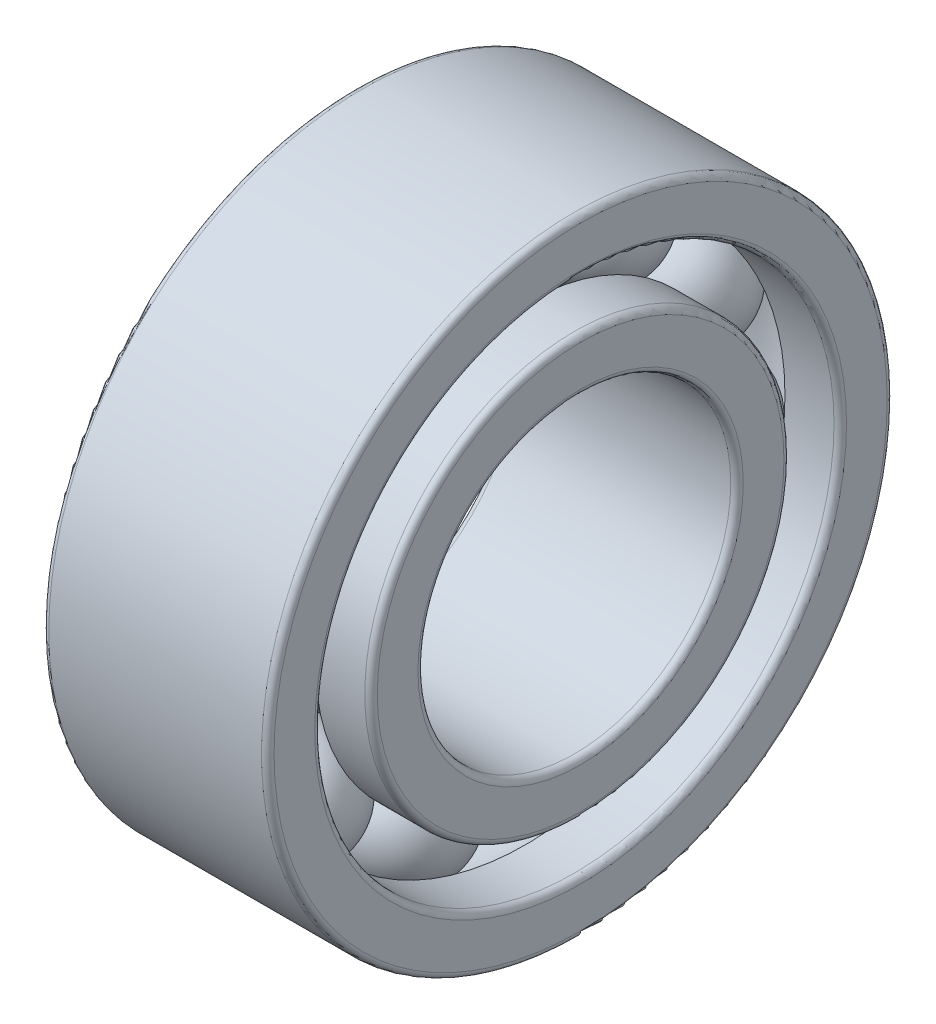
from build123d import *

# Parameters (mm, degrees)
CIRPATTERN4_COUNT = 11
FILLET1_R         = 0.5
FILLET2_R         = 0.5


with BuildPart() as part:
    # Sketch1 → Revolve1 (revolve)
    with BuildSketch(Plane.XY, mode=Mode.PRIVATE) as revolve1_sk:
        with BuildLine():
            Line((0, 25), (-18, 25))
            Line((-18, 25), (-18, 20.75))
            Line((-18, 20.75), (-13.582575695, 20.75))
            ThreePointArc((-13.582575695, 20.75), (-9, 23.75), (-4.417424305, 20.75))
            Line((-4.417424305, 20.75), (0, 20.75))
            Line((0, 20.75), (0, 25))
        make_face()
        with BuildLine():
            Line((-18, 12.5), (0, 12.5))
            Line((0, 12.5), (0, 16.75))
            Line((0, 16.75), (-4.417424305, 16.75))
            ThreePointArc((-4.417424305, 16.75), (-9, 13.75), (-13.582575695, 16.75))
            Line((-13.582575695, 16.75), (-18, 16.75))
            Line((-18, 16.75), (-18, 12.5))
        make_face()
    revolve(revolve1_sk.sketch.rotate(Axis((0, 0, 0), (-1, 0, 0)), 90), axis=Axis((0, 0, 0), (-1, 0, 0)))

    # Fillet1
    fillet1_edges = [part.edges().sort_by_distance(p)[0] for p in [
        (0, 0, 12.5),
        (-18, 0, 12.5),
        (-18, 0, 16.75),
        (0, 0, 16.75),
    ]]
    fillet(fillet1_edges, radius=FILLET1_R)

    # Fillet2
    fillet2_edges = [part.edges().sort_by_distance(p)[0] for p in [
        (0, 0, 20.75),
        (-18, 0, 20.75),
        (-18, 0, 25),
        (0, 0, 25),
    ]]
    fillet(fillet2_edges, radius=FILLET2_R)


with BuildPart() as body_2:
    # Sketch2 → Revolve2 (revolve)
    with BuildSketch(Plane.XY):
        with BuildLine():
            Line((-13.75, 18.75), (-4.25, 18.75))
            ThreePointArc((-4.25, 18.75), (-9, 14), (-13.75, 18.75))
        make_face()
    revolve(axis=Axis((-13.75, 18.75, 0), (1, 0, 0)))


with BuildPart() as cirpattern4_1:
    # CirPattern4: pattern copy
    add(body_2.part.rotate(Axis((0, 0, 0), (1, 0, 0)), 1 * 360 / CIRPATTERN4_COUNT))


with BuildPart() as cirpattern4_2:
    # CirPattern4: pattern copy
    add(body_2.part.rotate(Axis((0, 0, 0), (1, 0, 0)), 2 * 360 / CIRPATTERN4_COUNT))


with BuildPart() as cirpattern4_3:
    # CirPattern4: pattern copy
    add(body_2.part.rotate(Axis((0, 0, 0), (1, 0, 0)), 3 * 360 / CIRPATTERN4_COUNT))


with BuildPart() as cirpattern4_4:
    # CirPattern4: pattern copy
    add(body_2.part.rotate(Axis((0, 0, 0), (1, 0, 0)), 4 * 360 / CIRPATTERN4_COUNT))


with BuildPart() as cirpattern4_5:
    # CirPattern4: pattern copy
    add(body_2.part.rotate(Axis((0, 0, 0), (1, 0, 0)), 5 * 360 / CIRPATTERN4_COUNT))


with BuildPart() as cirpattern4_6:
    # CirPattern4: pattern copy
    add(body_2.part.rotate(Axis((0, 0, 0), (1, 0, 0)), 6 * 360 / CIRPATTERN4_COUNT))


with BuildPart() as cirpattern4_7:
    # CirPattern4: pattern copy
    add(body_2.part.rotate(Axis((0, 0, 0), (1, 0, 0)), 7 * 360 / CIRPATTERN4_COUNT))


with BuildPart() as cirpattern4_8:
    # CirPattern4: pattern copy
    add(body_2.part.rotate(Axis((0, 0, 0), (1, 0, 0)), 8 * 360 / CIRPATTERN4_COUNT))


with BuildPart() as cirpattern4_9:
    # CirPattern4: pattern copy
    add(body_2.part.rotate(Axis((0, 0, 0), (1, 0, 0)), 9 * 360 / CIRPATTERN4_COUNT))


with BuildPart() as cirpattern4_10:
    # CirPattern4: pattern copy
    add(body_2.part.rotate(Axis((0, 0, 0), (1, 0, 0)), 10 * 360 / CIRPATTERN4_COUNT))


solid = Compound([part.part, body_2.part, cirpattern4_1.part, cirpattern4_2.part, cirpattern4_3.part, cirpattern4_4.part, cirpattern4_5.part, cirpattern4_6.part, cirpattern4_7.part, cirpattern4_8.part, cirpattern4_9.part, cirpattern4_10.part])
